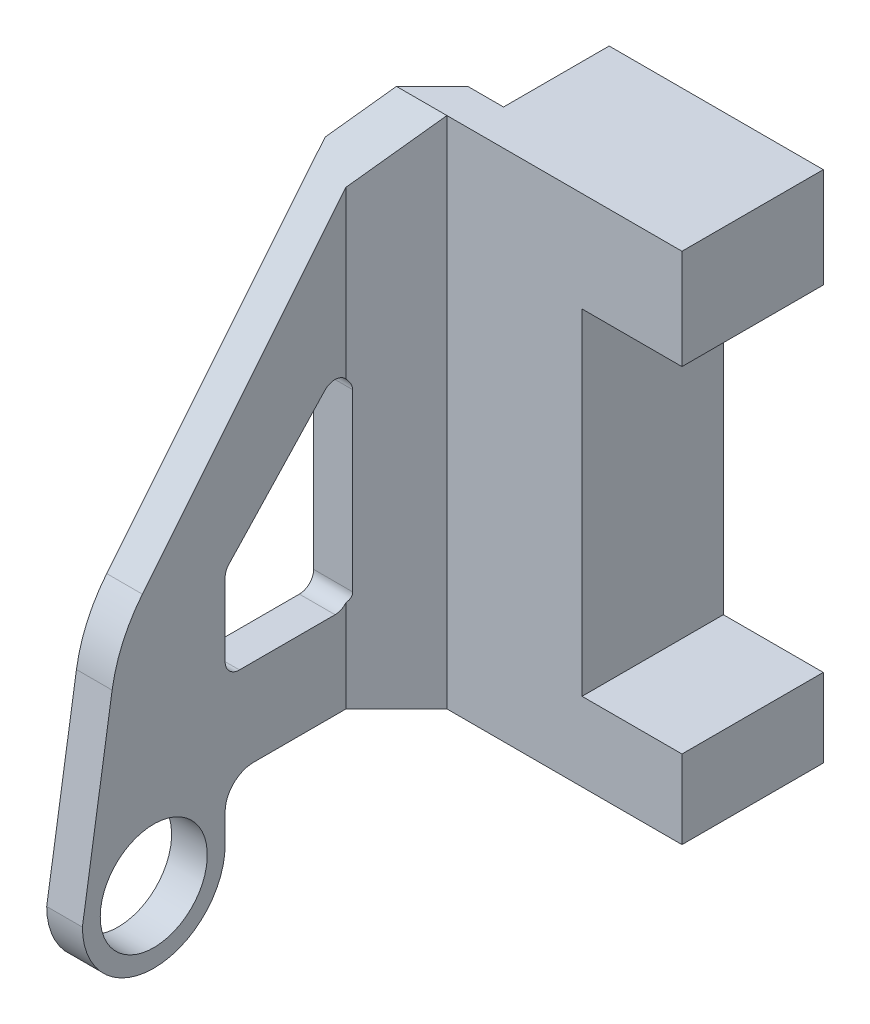
from build123d import *

# Parameters (mm, degrees)
SZKIC1_W                    = 15
SZKIC1_H                    = 36
DODANIE_WYCI_GNI_CIE1_DEPTH = 9.9
SZKIC2_W                    = 7
SZKIC2_H                    = 23.5
WYTNIJ_WYCI_GNI_CIE1_DEPTH  = 9.9
SZKIC3_R                    = 2.5
DODANIE_WYCI_GNI_CIE2_DEPTH = 7.5
WYTNIJ_WYCI_GNI_CIE2_DEPTH  = 137.5
WYTNIJ_WYCI_GNI_CIE3_DEPTH  = 137.5
ZAOKR_GLENIE1_R             = 10
ZAOKR_GLENIE2_R             = 2
SZKIC6_R                    = 3.75
WYTNIJ_WYCI_GNI_CIE4_DEPTH  = 10


with BuildPart() as part:
    # Szkic1 → Dodanie-wyciągnięcie1 (new body)
    with BuildSketch(Plane.XY):
        with Locations((-7.5, 18)):
            Rectangle(SZKIC1_W, SZKIC1_H)
    extrude(amount=DODANIE_WYCI_GNI_CIE1_DEPTH)

    # Szkic2 → Wytnij-wyciągnięcie1 (cut)
    with BuildSketch(Plane.XY.offset(9.9)):
        with Locations((-3.5, 17.25)):
            Rectangle(SZKIC2_W, SZKIC2_H)
    extrude(amount=-WYTNIJ_WYCI_GNI_CIE1_DEPTH, mode=Mode.SUBTRACT)

    # Szkic3 → Dodanie-wyciągnięcie2 (add)
    with BuildSketch(Plane.ZY.offset(15)):
        with BuildLine():
            Line((7.4, 36), (9.9, 36))
            Line((9.9, 36), (12.4, 32.923076923))
            Line((12.4, 32.923076923), (29.4, 12))
            Line((29.4, 12), (31.9, -4))
            ThreePointArc((31.9, -4), (26.9, -9), (21.9, -4))
            Line((21.9, -4), (21.9, 0))
            Line((21.9, 0), (12.4, 0))
            Line((12.4, 0), (7.4, 0))
            Line((7.4, 0), (7.4, 36))
        make_face()
        with Locations((26.9, -4)):
            Circle(SZKIC3_R, mode=Mode.SUBTRACT)
    extrude(amount=DODANIE_WYCI_GNI_CIE2_DEPTH)

    # Szkic4 → Wytnij-wyciągnięcie2 (cut)
    with BuildSketch(Plane(origin=(0, 36, 0), x_dir=(1, 0, 0), z_dir=(0, 1, 0))):
        Polygon((-17.5, -7.4), (-25.001097051, -14.901097051), (-26.525986736, -7.4), align=None)
        Polygon((-16.464466094, -9.9), (-20, -13.435533906), (-20, -34.97095788), (-2.856589665, -34.97095788), (-4.384348652, -9.9), align=None)
    extrude(amount=-WYTNIJ_WYCI_GNI_CIE2_DEPTH, mode=Mode.SUBTRACT)

    # Szkic5 → Wytnij-wyciągnięcie3 (cut)
    with BuildSketch(Plane.ZY.offset(22.5)):
        with BuildLine():
            Line((14.930271414, 20.050399523), (21.630271414, 12.888330558))
            ThreePointArc((21.630271414, 12.888330558), (21.830126715, 12.572412171), (21.9, 12.205173429))
            Line((21.9, 12.205173429), (21.9, 7.1))
            ThreePointArc((21.9, 7.1), (21.607106781, 6.392893219), (20.9, 6.1))
            Line((20.9, 6.1), (14.2, 6.1))
            ThreePointArc((14.2, 6.1), (13.492893219, 6.392893219), (13.2, 7.1))
            Line((13.2, 7.1), (13.2, 19.367242395))
            ThreePointArc((13.2, 19.367242395), (13.832761259, 20.29736911), (14.930271414, 20.050399523))
        make_face()
    extrude(amount=-WYTNIJ_WYCI_GNI_CIE3_DEPTH, mode=Mode.SUBTRACT)

    # Zaokrąglenie1
    zaokr_glenie1_edges = [part.edges().sort_by_distance(p)[0] for p in [
        (-21.25, 12, 29.4),
    ]]
    fillet(zaokr_glenie1_edges, radius=ZAOKR_GLENIE1_R)

    # Zaokrąglenie2
    zaokr_glenie2_edges = [part.edges().sort_by_distance(p)[0] for p in [
        (-21.25, 0, 21.9),
    ]]
    fillet(zaokr_glenie2_edges, radius=ZAOKR_GLENIE2_R)

    # Szkic6 → Wytnij-wyciągnięcie4 (cut)
    with BuildSketch(Plane.ZY.offset(22.5)):
        with Locations((26.9, -4)):
            Circle(SZKIC6_R)
    extrude(amount=-WYTNIJ_WYCI_GNI_CIE4_DEPTH, mode=Mode.SUBTRACT)


solid = part.part
